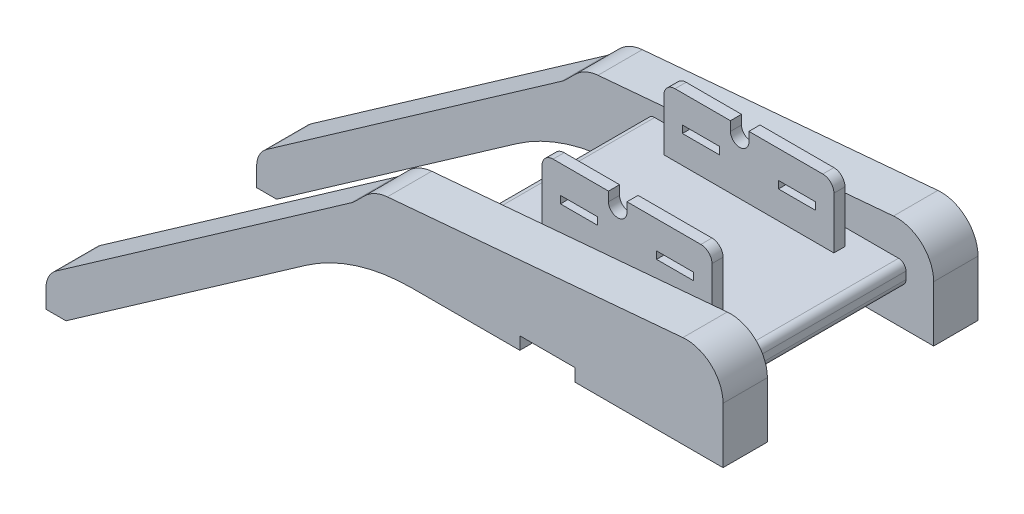
from build123d import *

# Parameters (mm, degrees)
BOSS_EXTRUDE1_DEPTH  = 152.4
SKETCH2_W            = 190.5
SKETCH2_H            = 190.5
CUT_EXTRUDE1_DEPTH   = 254
BOSS_EXTRUDE2_DEPTH  = 571.5
FILLET1_R            = 127
FILLET1_OF_MIRROR1_R = 127
SKETCH8_W            = 127
SKETCH8_H            = 25.4
BOSS_EXTRUDE3_DEPTH  = 38.1
CUT_EXTRUDE2_DEPTH   = 43.18


with BuildPart() as part:
    # Sketch1 → Boss-Extrude1 (new body)
    with BuildSketch(Plane.XY):
        with BuildLine():
            Line((213.019747539, -692.104923164), (213.019747539, -628.039977762))
            ThreePointArc((213.019747539, -628.039977762), (222.347003261, -589.92262974), (248.221012719, -560.418976506))
            Line((248.221012719, -560.418976506), (1260.898352267, 148.66533042))
            ThreePointArc((1260.898352267, 148.66533042), (1269.688171281, 155.409995769), (1277.856706062, 162.895078834))
            Line((1277.856706062, 162.895078834), (1307.506572341, 192.544945114))
            ThreePointArc((1307.506572341, 192.544945114), (1343.636614311, 217.843472857), (1386.240354223, 229.259110561))
            Line((1386.240354223, 229.259110561), (2540, 330.2))
            Line((2540, 330.2), (2540, 0))
            Line((2540, 0), (1470.214730938, 0))
            ThreePointArc((1470.214730938, 0), (1279.266548253, -29.389736275), (1105.993693855, -114.838451876))
            Line((1105.993693855, -114.838451876), (281.571733527, -692.104923164))
            Line((281.571733527, -692.104923164), (213.019747539, -692.104923164))
        make_face()
    boss_extrude1 = extrude(amount=BOSS_EXTRUDE1_DEPTH)

    # Sketch2 → Cut-Extrude1 (cut)
    with BuildSketch(Plane.XY.offset(152.4)):
        with Locations((1936.75, -51.816)):
            Rectangle(SKETCH2_W, SKETCH2_H)
    cut_extrude1 = extrude(amount=-CUT_EXTRUDE1_DEPTH, mode=Mode.SUBTRACT)

    # Sketch4 → Boss-Extrude2 (add)
    with BuildSketch(Plane.XY.offset(152.4)):
        with BuildLine():
            Line((1581.15, 124.78955528), (2419.35, 124.78955528))
            ThreePointArc((2419.35, 124.78955528), (2437.310512242, 132.229043038), (2444.75, 150.18955528))
            Line((2444.75, 150.18955528), (2444.75, 175.58955528))
            ThreePointArc((2444.75, 175.58955528), (2437.310512242, 193.550067523), (2419.35, 200.98955528))
            Line((2419.35, 200.98955528), (1581.15, 200.98955528))
            ThreePointArc((1581.15, 200.98955528), (1563.189487758, 193.550067523), (1555.75, 175.58955528))
            Line((1555.75, 175.58955528), (1555.75, 150.18955528))
            ThreePointArc((1555.75, 150.18955528), (1563.189487758, 132.229043038), (1581.15, 124.78955528))
        make_face()
    extrude(amount=BOSS_EXTRUDE2_DEPTH)

    # Fillet1
    fillet1_edges = [part.edges().sort_by_distance(p)[0] for p in [
        (2540, 330.2, 76.2),
    ]]
    fillet(fillet1_edges, radius=FILLET1_R)

    # Mirror1: Boss-Extrude1, Cut-Extrude1 across plane
    add(boss_extrude1.mirror(Plane.XY.offset(438.15)))
    add(cut_extrude1.mirror(Plane.XY.offset(438.15)), mode=Mode.SUBTRACT)

    # Fillet1 of Mirror1
    fillet1_of_mirror1_edges = [part.edges().sort_by_distance(p)[0] for p in [
        (2540, 330.2, 800.1),
    ]]
    fillet(fillet1_of_mirror1_edges, radius=FILLET1_OF_MIRROR1_R)

    # Sketch8 → Boss-Extrude3 (add)
    with BuildSketch(Plane.XY.offset(247.65)):
        with BuildLine():
            Line((1708.15, 200.98955528), (1708.15, 378.78955528))
            ThreePointArc((1708.15, 378.78955528), (1719.309231637, 405.730323644), (1746.25, 416.88955528))
            Line((1746.25, 416.88955528), (2254.25, 416.88955528))
            ThreePointArc((2254.25, 416.88955528), (2281.190768363, 405.730323644), (2292.35, 378.78955528))
            Line((2292.35, 378.78955528), (2292.35, 200.98955528))
            Line((2292.35, 200.98955528), (1708.15, 200.98955528))
        make_face()
        with Locations((1835.15, 308.93955528)):
            Rectangle(SKETCH8_W, SKETCH8_H, mode=Mode.SUBTRACT)
        with Locations((2165.35, 308.93955528)):
            Rectangle(SKETCH8_W, SKETCH8_H, mode=Mode.SUBTRACT)
    boss_extrude3 = extrude(amount=-BOSS_EXTRUDE3_DEPTH)

    # Sketch9 → Cut-Extrude2 (cut)
    with BuildSketch(Plane.XY.offset(247.65)):
        with BuildLine():
            Line((1936.75, 385.13955528), (1936.75, 416.88955528))
            Line((1936.75, 416.88955528), (2000.25, 416.88955528))
            Line((2000.25, 416.88955528), (2000.25, 385.13955528))
            ThreePointArc((2000.25, 385.13955528), (1968.5, 353.38955528), (1936.75, 385.13955528))
        make_face()
    cut_extrude2 = extrude(amount=-CUT_EXTRUDE2_DEPTH, mode=Mode.SUBTRACT)

    # Mirror2: Boss-Extrude3, Cut-Extrude2 across plane
    add(boss_extrude3.mirror(Plane.XY.offset(438.15)))
    add(cut_extrude2.mirror(Plane.XY.offset(438.15)), mode=Mode.SUBTRACT)


solid = part.part
